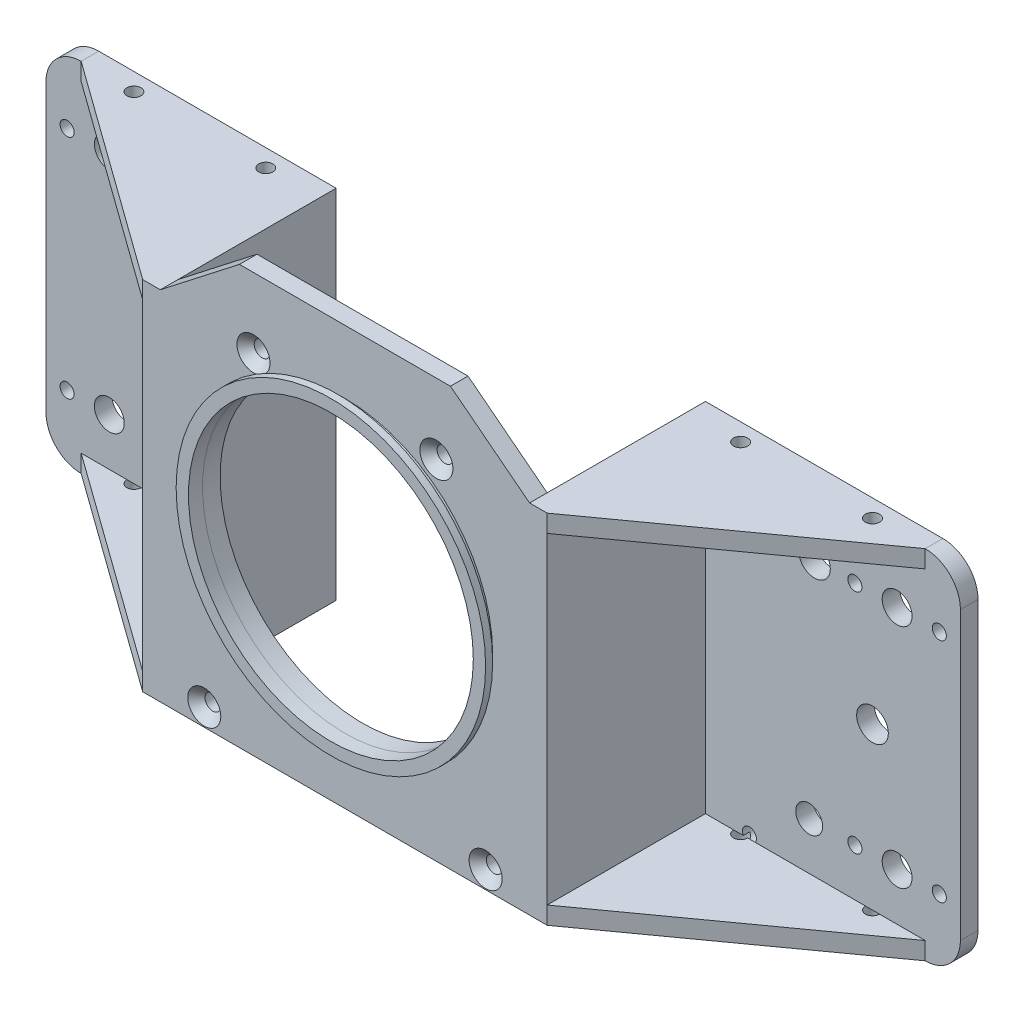
from build123d import *

# Parameters (mm, degrees)
SKIZZE1_R                                      = 2.25
SKIZZE1_R_2                                    = 40.5
AUFSATZ_LINEAR_AUSTRAGEN1_DEPTH                = 5
SKETCH5_W                                      = 5
SKETCH5_H                                      = 101.5
BOSS_EXTRUDE1_DEPTH                            = 50
SKIZZE15_R                                     = 4.25
SKIZZE15_R_2                                   = 2
AUFSATZ_LINEAR_AUSTRAGEN2_DEPTH                = 5
CUT_EXTRUDE1_DEPTH                             = 151.083310198
CUT_EXTRUDE1_DEPTH_BACK                        = 151.083310198
SKETCH1_R                                      = 4.5
SKETCH1_R_2                                    = 3.819823324
SKETCH1_R_3                                    = 2
BOSS_EXTRUDE2_DEPTH                            = 5
SKETCH11_R                                     = 2
CUT_EXTRUDE2_DEPTH                             = 5
LPATTERN1_COPY_1_DEPTH                         = 5
LPATTERN1_COPY_2_SKETCH_R                      = 2
LPATTERN1_COPY_2_DEPTH                         = 5
LPATTERN1_COPY_3_DEPTH                         = 5
LPATTERN1_COPY_4_SKETCH_R                      = 2
LPATTERN1_COPY_4_DEPTH                         = 5
SKETCH9_R                                      = 44
SKETCH9_R_2                                    = 40.5
BOSS_EXTRUDE3_DEPTH                            = 4
SKETCH13_R                                     = 44
SKETCH13_R_2                                   = 42
CUT_EXTRUDE3_DEPTH                             = 2
CSK_FOR_M4_FLAT_HEAD_MACHINE_SCREW1_AT_2_COUNT = 2
CSK_FOR_M4_FLAT_HEAD_MACHINE_SCREW1_AT_2_PITCH = 52
CSK_FOR_M4_FLAT_HEAD_MACHINE_SCREW1_AT_3_COUNT = 2
CSK_FOR_M4_FLAT_HEAD_MACHINE_SCREW1_AT_3_PITCH = 114.856432123
CSK_FOR_M4_FLAT_HEAD_MACHINE_SCREW1_AT_4_COUNT = 2
CSK_FOR_M4_FLAT_HEAD_MACHINE_SCREW1_AT_4_PITCH = 95.036834964


with BuildPart() as part:
    # Skizze1 → Aufsatz-Linear austragen1 (new body)
    with BuildSketch(Plane.XY):
        Polygon((-52.5, -59), (52.5, -59), (52.5, 42.5), (30, 60), (-30, 60), (-52.5, 42.5), align=None)
        with Locations((26, 40)):
            Circle(SKIZZE1_R, mode=Mode.SUBTRACT)
        with Locations((-26, 40)):
            Circle(SKIZZE1_R, mode=Mode.SUBTRACT)
        Circle(SKIZZE1_R_2, mode=Mode.SUBTRACT)
        with Locations((40, -54)):
            Circle(SKIZZE1_R, mode=Mode.SUBTRACT)
        with Locations((-40, -54)):
            Circle(SKIZZE1_R, mode=Mode.SUBTRACT)
    extrude(amount=AUFSATZ_LINEAR_AUSTRAGEN1_DEPTH)

    # Sketch5 → Boss-Extrude1 (add)
    with BuildSketch(Plane.XY.offset(5)):
        with Locations((55, -8.25)):
            Rectangle(SKETCH5_W, SKETCH5_H)
    boss_extrude1 = extrude(amount=-BOSS_EXTRUDE1_DEPTH)

    # Skizze15 → Aufsatz-Linear austragen2 (add)
    with BuildSketch(Plane.XY.offset(-45)):
        with BuildLine():
            Line((57.5, 42.5), (120, 42.5))
            ThreePointArc((120, 42.5), (127.071067812, 39.571067812), (130, 32.5))
            Line((130, 32.5), (130, -49))
            ThreePointArc((130, -49), (127.071067812, -56.071067812), (120, -59))
            Line((120, -59), (57.5, -59))
            Line((57.5, -59), (57.5, 42.5))
        make_face()
        with Locations((112, 24)):
            Circle(SKIZZE15_R, mode=Mode.SUBTRACT)
        with Locations((100, 24)):
            Circle(SKIZZE15_R_2, mode=Mode.SUBTRACT)
        with Locations((124, 24)):
            Circle(SKIZZE15_R_2, mode=Mode.SUBTRACT)
        with Locations((112, -40.5)):
            Circle(SKIZZE15_R, mode=Mode.SUBTRACT)
        with Locations((100, -40.5)):
            Circle(SKIZZE15_R_2, mode=Mode.SUBTRACT)
        with Locations((124, -40.5)):
            Circle(SKIZZE15_R_2, mode=Mode.SUBTRACT)
    aufsatz_linear_austragen2 = extrude(amount=AUFSATZ_LINEAR_AUSTRAGEN2_DEPTH)

    # Spiegeln1: Boss-Extrude1, Aufsatz-Linear austragen2 across plane
    add(boss_extrude1.mirror(Plane(origin=(0, 0, 0), x_dir=(0, 0, 1), z_dir=(1, 0, 0))))
    add(aufsatz_linear_austragen2.mirror(Plane(origin=(0, 0, 0), x_dir=(0, 0, 1), z_dir=(1, 0, 0))))

    # Sketch1 → Cut-Extrude1 (cut, two sides: drawn at the far end of the back side and taken through both)
    with BuildSketch(Plane.XY.offset(-40).offset(-CUT_EXTRUDE1_DEPTH_BACK)):
        with Locations((105, -8.25)):
            Circle(SKETCH1_R)
        with Locations((87, -40.5)):
            Circle(SKETCH1_R_2)
        with Locations((88.5, 24)):
            Circle(SKETCH1_R)
        with Locations((70, -53)):
            Circle(SKETCH1_R_3)
        with Locations((70, 36.5)):
            Circle(SKETCH1_R_3)
    extrude(amount=CUT_EXTRUDE1_DEPTH + CUT_EXTRUDE1_DEPTH_BACK, mode=Mode.SUBTRACT)

    # Sketch6 → Boss-Extrude2 (add)
    with BuildSketch(Plane.XZ.offset(59)):
        Polygon((57.5, 5), (120, -40), (57.5, -40), align=None)
    boss_extrude2 = extrude(amount=-BOSS_EXTRUDE2_DEPTH)

    # Sketch11 → Cut-Extrude2 (cut)
    with BuildSketch(Plane.XZ.offset(59)):
        with Locations((105, -40)):
            Circle(SKETCH11_R)
        with Locations((67.5, -40)):
            Circle(SKETCH11_R)
    cut_extrude2 = extrude(amount=-CUT_EXTRUDE2_DEPTH, mode=Mode.SUBTRACT)

    # Mirror1: Boss-Extrude2, Cut-Extrude2 across plane
    add(boss_extrude2.mirror(Plane(origin=(0, 0, 0), x_dir=(0, 0, 1), z_dir=(1, 0, 0))))
    add(cut_extrude2.mirror(Plane(origin=(0, 0, 0), x_dir=(0, 0, 1), z_dir=(1, 0, 0))), mode=Mode.SUBTRACT)

    # LPattern1 copy 1 sketch → LPattern1 copy 1 (add)
    with BuildSketch(Plane(origin=(0, 37.5, 0), x_dir=(-1, 0, 0), z_dir=(0, -1, 0))):
        Polygon((57.5, -5), (120, 40), (57.5, 40), align=None)
    extrude(amount=-LPATTERN1_COPY_1_DEPTH)

    # LPattern1 copy 2 sketch → LPattern1 copy 2 (cut)
    with BuildSketch(Plane(origin=(0, 37.5, 0), x_dir=(-1, 0, 0), z_dir=(0, -1, 0))):
        with Locations((105, 40)):
            Circle(LPATTERN1_COPY_2_SKETCH_R)
        with Locations((67.5, 40)):
            Circle(LPATTERN1_COPY_2_SKETCH_R)
    extrude(amount=-LPATTERN1_COPY_2_DEPTH, mode=Mode.SUBTRACT)

    # LPattern1 copy 3 sketch → LPattern1 copy 3 (add)
    with BuildSketch(Plane.XZ.offset(-37.5)):
        Polygon((57.5, 5), (120, -40), (57.5, -40), align=None)
    extrude(amount=-LPATTERN1_COPY_3_DEPTH)

    # LPattern1 copy 4 sketch → LPattern1 copy 4 (cut)
    with BuildSketch(Plane.XZ.offset(-37.5)):
        with Locations((105, -40)):
            Circle(LPATTERN1_COPY_4_SKETCH_R)
        with Locations((67.5, -40)):
            Circle(LPATTERN1_COPY_4_SKETCH_R)
    extrude(amount=-LPATTERN1_COPY_4_DEPTH, mode=Mode.SUBTRACT)

    # Sketch15 → CSK for M4 Flat Head Machine Screw1 (revolve, cut)
    with BuildSketch(Plane(origin=(-26, 40, 5), x_dir=(0, -1, 0), z_dir=(1, 0, 0))):
        Polygon((0, 0), (0, 50), (2.25, 50), (2.25, 2.45), (4.7, 0), align=None)
    csk_for_m4_flat_head_machine_screw1 = revolve(axis=Axis((-26, 40, 11.35), (0, 0, -1)), mode=Mode.SUBTRACT)

    # CSK for M4 Flat Head Machine Screw1 at 2: CSK for M4 Flat Head Machine Screw1 ×2
    with Locations(*[(i * CSK_FOR_M4_FLAT_HEAD_MACHINE_SCREW1_AT_2_PITCH, 0, 0) for i in range(1, CSK_FOR_M4_FLAT_HEAD_MACHINE_SCREW1_AT_2_COUNT)]):
        add(csk_for_m4_flat_head_machine_screw1, mode=Mode.SUBTRACT)

    # CSK for M4 Flat Head Machine Screw1 at 3: CSK for M4 Flat Head Machine Screw1 ×2
    with Locations(*[Vector(0.5746304214759498, -0.8184130245263528, 0) * (i * CSK_FOR_M4_FLAT_HEAD_MACHINE_SCREW1_AT_3_PITCH) for i in range(1, CSK_FOR_M4_FLAT_HEAD_MACHINE_SCREW1_AT_3_COUNT)]):
        add(csk_for_m4_flat_head_machine_screw1, mode=Mode.SUBTRACT)

    # CSK for M4 Flat Head Machine Screw1 at 4: CSK for M4 Flat Head Machine Screw1 ×2
    with Locations(*[Vector(-0.1473113030887813, -0.9890901778818174, 0) * (i * CSK_FOR_M4_FLAT_HEAD_MACHINE_SCREW1_AT_4_PITCH) for i in range(1, CSK_FOR_M4_FLAT_HEAD_MACHINE_SCREW1_AT_4_COUNT)]):
        add(csk_for_m4_flat_head_machine_screw1, mode=Mode.SUBTRACT)


with BuildPart() as body_2:
    # Sketch9 → Boss-Extrude3 (new body)
    with BuildSketch(Plane.XY.offset(5)):
        Circle(SKETCH9_R)
        Circle(SKETCH9_R_2, mode=Mode.SUBTRACT)
    extrude(amount=BOSS_EXTRUDE3_DEPTH)

    # Sketch13 → Cut-Extrude3 (cut)
    with BuildSketch(Plane.XY.offset(5)):
        Circle(SKETCH13_R)
        Circle(SKETCH13_R_2, mode=Mode.SUBTRACT)
    extrude(amount=CUT_EXTRUDE3_DEPTH, mode=Mode.SUBTRACT)


solid = Compound([part.part, body_2.part])
